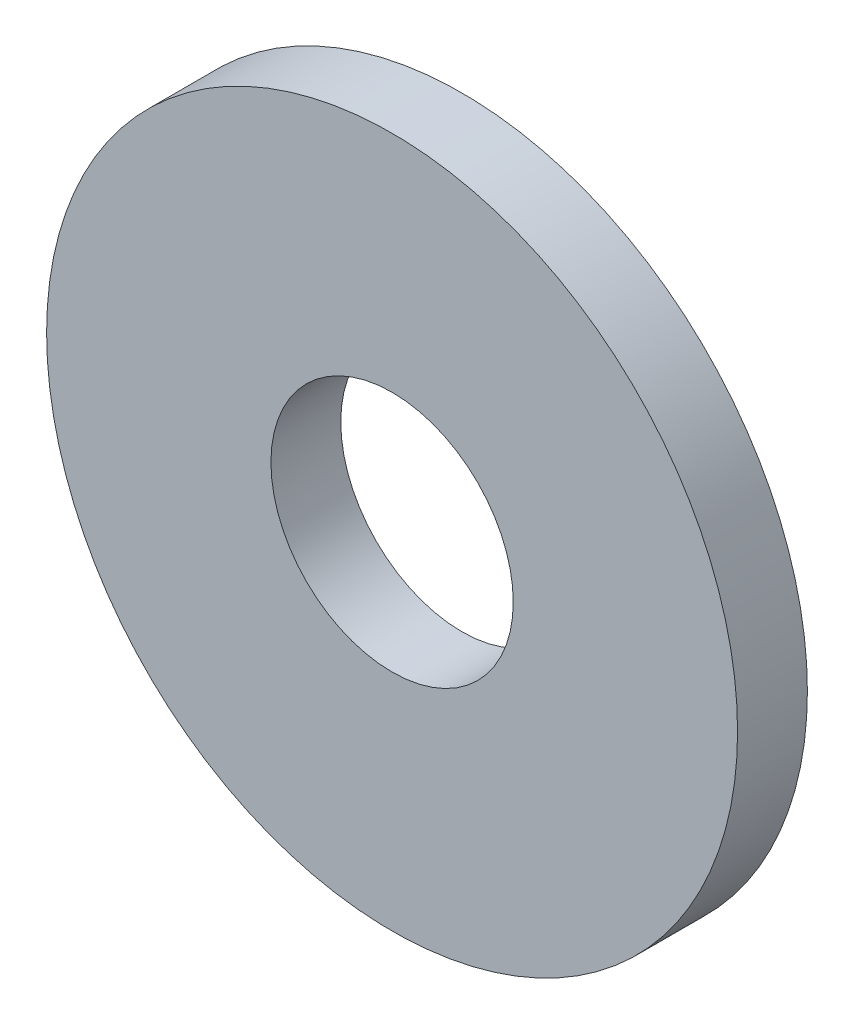
from build123d import *

# Parameters (mm, degrees)
SKETCH1_R           = 8.411972439
SKETCH1_R_2         = 2.95
BOSS_EXTRUDE1_DEPTH = 1.7


with BuildPart() as part:
    # Sketch1 → Boss-Extrude1 (new body)
    with BuildSketch(Plane.XY):
        Circle(SKETCH1_R)
        Circle(SKETCH1_R_2, mode=Mode.SUBTRACT)
    extrude(amount=BOSS_EXTRUDE1_DEPTH)


solid = part.part
